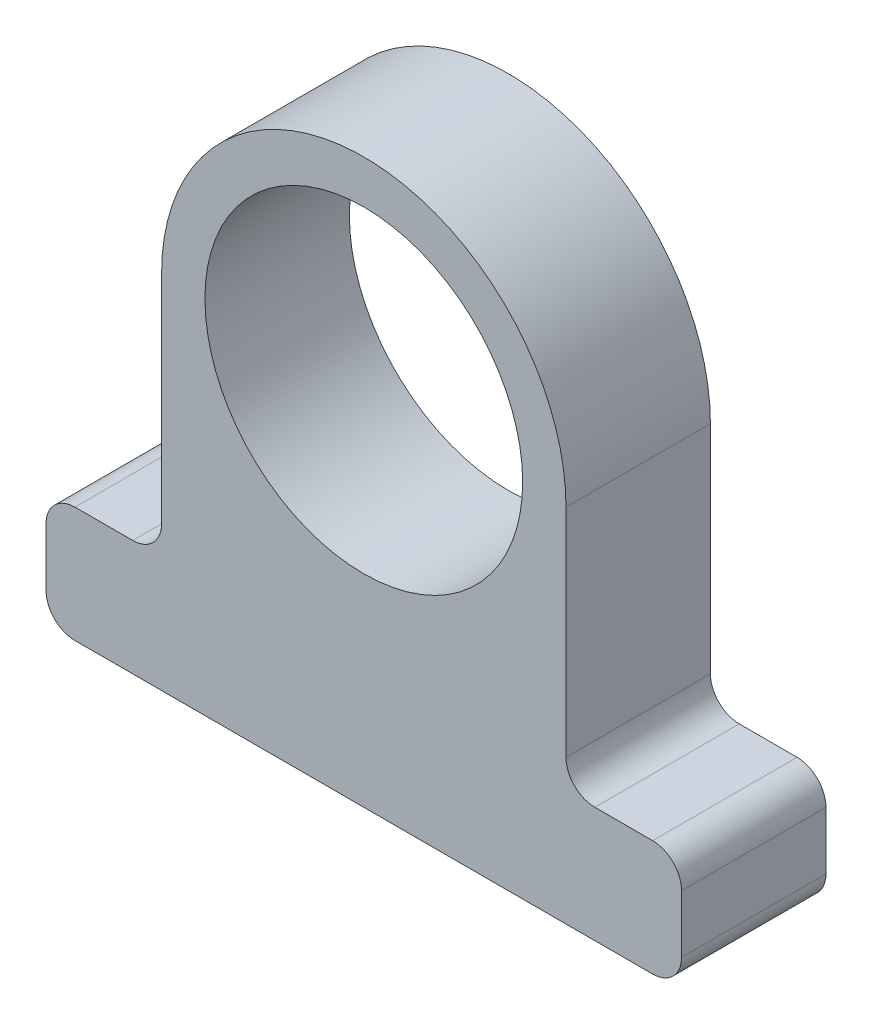
from build123d import *

# Parameters (mm, degrees)
SKETCH1_R           = 14
SKETCH1_R_2         = 11
BOSS_EXTRUDE1_DEPTH = 10
FILLET1_R           = 2


with BuildPart() as part:
    # Sketch1 → Boss-Extrude1 (new body)
    # profile 1 of 2: a face of its own
    with BuildSketch(Plane.XY):
        with BuildLine():
            ThreePointArc((14, 0), (0, -14), (-14, 0))
            Line((-14, 0), (-14, -17))
            Line((-14, -17), (-22, -17))
            Line((-22, -17), (-22, -25))
            Line((-22, -25), (22, -25))
            Line((22, -25), (22, -17))
            Line((22, -17), (14, -17))
            Line((14, -17), (14, 0))
        make_face()
    # profile 2 of 2: a face of its own
    with BuildSketch(Plane.XY):
        Circle(SKETCH1_R)
        Circle(SKETCH1_R_2, mode=Mode.SUBTRACT)
    extrude(amount=BOSS_EXTRUDE1_DEPTH)

    # Fillet1
    fillet1_edges = [part.edges().sort_by_distance(p)[0] for p in [
        (14, -17, 5),
        (22, -17, 5),
        (22, -25, 5),
        (-22, -25, 5),
        (-22, -17, 5),
        (-14, -17, 5),
    ]]
    fillet(fillet1_edges, radius=FILLET1_R)


solid = part.part
